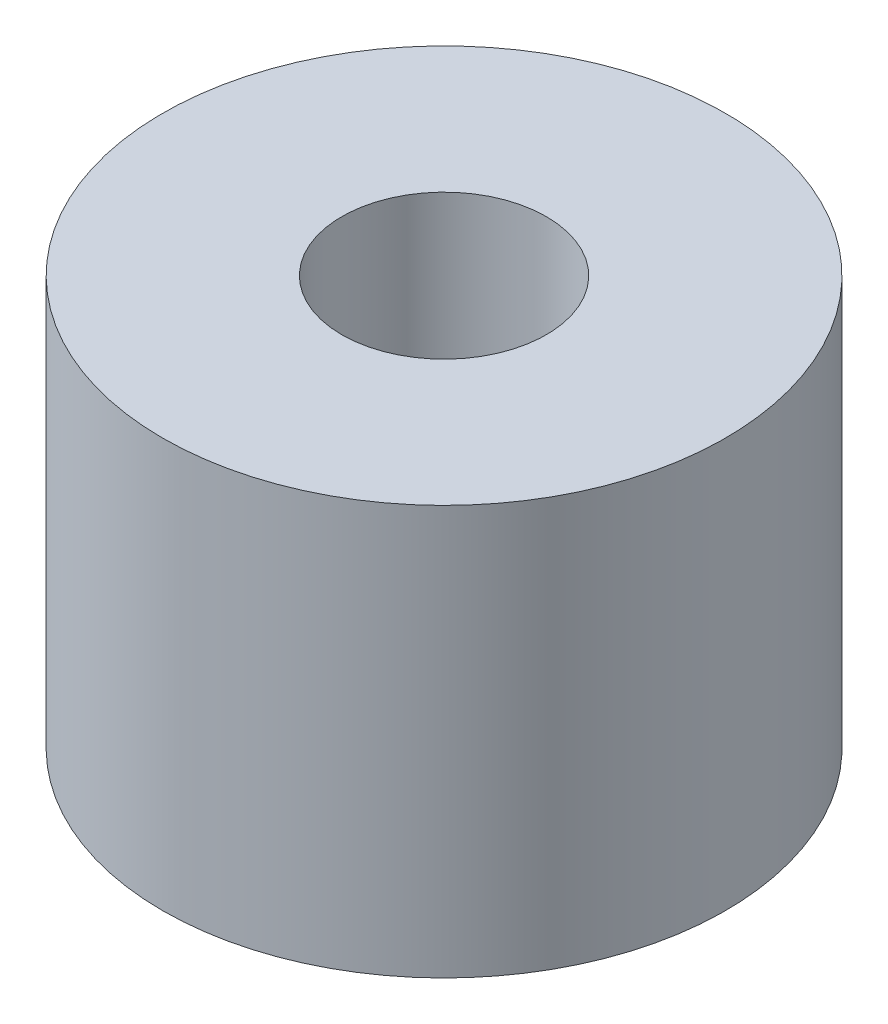
from build123d import *

# Parameters (mm, degrees)
SKETCH1_R           = 11
SKETCH1_R_2         = 4
BOSS_EXTRUDE1_DEPTH = 16


with BuildPart() as part:
    # Sketch1 → Boss-Extrude1 (new body)
    with BuildSketch(Plane(origin=(0, 0, 0), x_dir=(1, 0, 0), z_dir=(0, 1, 0))):
        with Locations(Location((0, 0, 0), (0, 0, 270))):
            Circle(SKETCH1_R)
        with Locations(Location((0, 0, 0), (0, 0, 270))):
            Circle(SKETCH1_R_2, mode=Mode.SUBTRACT)
    extrude(amount=BOSS_EXTRUDE1_DEPTH)


solid = part.part
